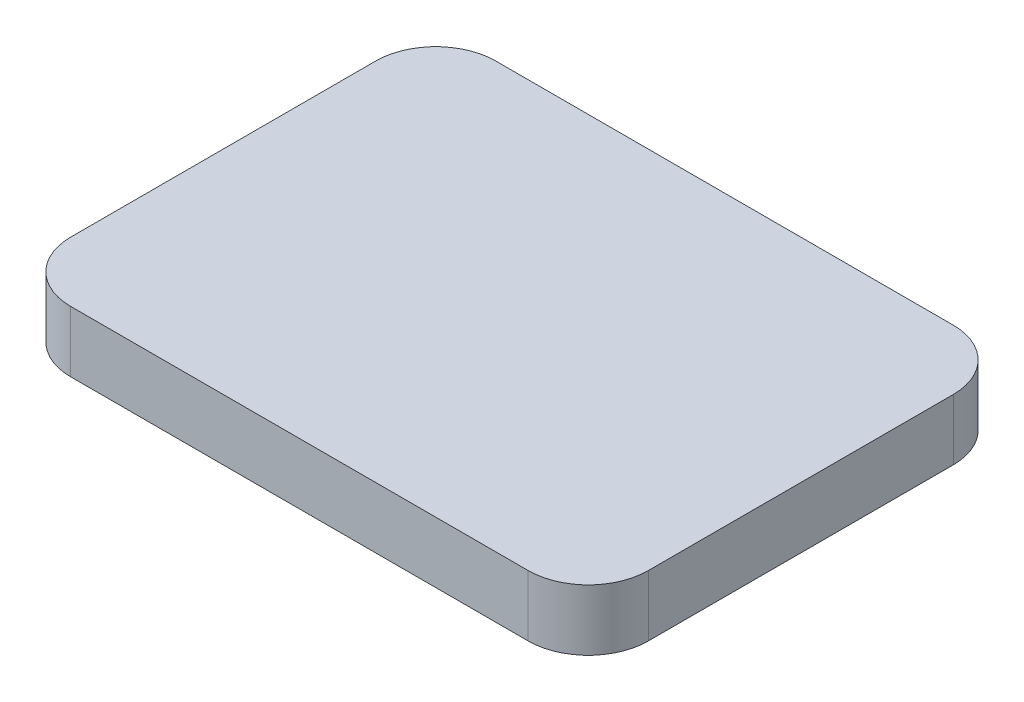
from build123d import *

# Parameters (mm, degrees)
BOSS_EXTRUDE1_DEPTH = 10.16


with BuildPart() as part:
    # Sketch1 → Boss-Extrude1 (new body)
    with BuildSketch(Plane(origin=(0, 0, 0), x_dir=(1, 0, 0), z_dir=(0, 1, 0))):
        with BuildLine():
            Line((-38.1, -35.4), (38.1, -35.4))
            ThreePointArc((38.1, -35.4), (45.171067812, -32.471067812), (48.1, -25.4))
            Line((48.1, -25.4), (48.1, 25.4))
            ThreePointArc((48.1, 25.4), (45.171067812, 32.471067812), (38.1, 35.4))
            Line((38.1, 35.4), (-38.1, 35.4))
            ThreePointArc((-38.1, 35.4), (-45.171067812, 32.471067812), (-48.1, 25.4))
            Line((-48.1, 25.4), (-48.1, -25.4))
            ThreePointArc((-48.1, -25.4), (-45.171067812, -32.471067812), (-38.1, -35.4))
        make_face()
    extrude(amount=BOSS_EXTRUDE1_DEPTH)


solid = part.part
